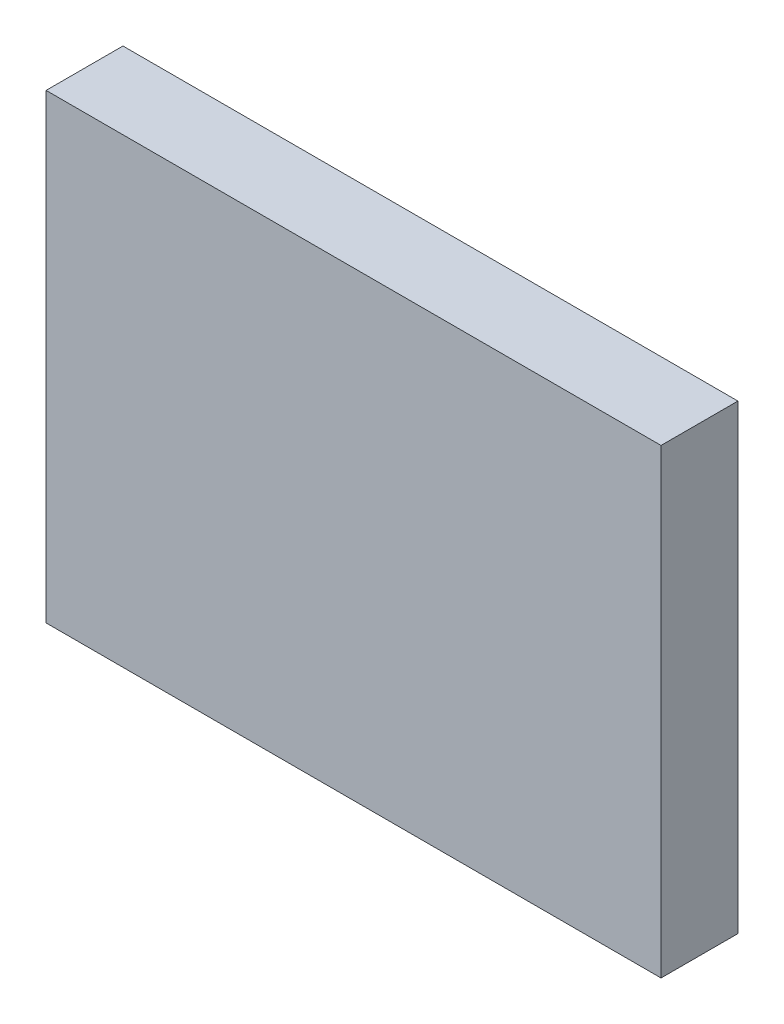
from build123d import *

# Parameters (mm, degrees)
ESQUISSE1_W        = 80
ESQUISSE1_H        = 60
BOSS_EXTRU_1_DEPTH = 10


with BuildPart() as part:
    # Esquisse1 → Boss.-Extru.1 (new body)
    with BuildSketch(Plane.XY):
        with Locations((40, -30)):
            Rectangle(ESQUISSE1_W, ESQUISSE1_H)
    extrude(amount=BOSS_EXTRU_1_DEPTH)


solid = part.part
